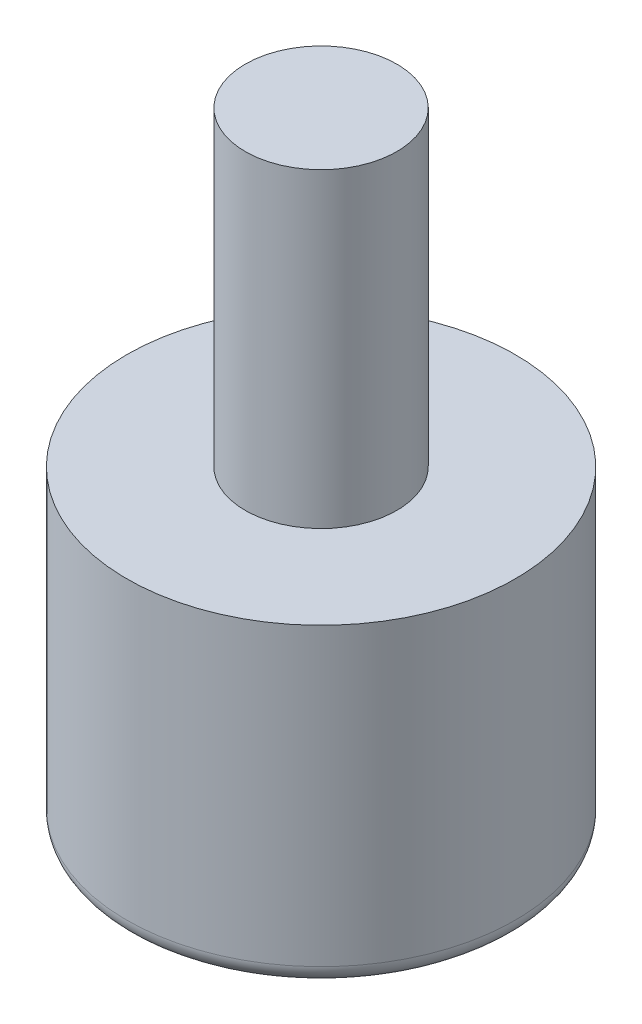
from build123d import *

# Parameters (mm, degrees)
CONG_1_R = 1


with BuildPart() as part:
    # Esquisse1 → Révolution1 (revolve)
    with BuildSketch(Plane.XY, mode=Mode.PRIVATE) as r_volution1_sk:
        with BuildLine():
            Line((10.25, 0), (6, 0))
            ThreePointArc((6, 0), (3.44818793, -2.490919876), (0, -3.4))
            Line((0, -3.4), (0, 0))
            Line((0, 0), (0, 33))
            Line((0, 33), (4, 33))
            Line((4, 33), (4, 16.6))
            Line((4, 16.6), (10.25, 16.6))
            Line((10.25, 16.6), (10.25, 0))
        make_face()
    revolve(r_volution1_sk.sketch.rotate(Axis((0, 33, 0), (0, -1, 0)), 180), axis=Axis((0, 33, 0), (0, -1, 0)))

    # Congé1
    cong_1_edges = [part.edges().sort_by_distance(p)[0] for p in [
        (10.25, 0, 0),
    ]]
    fillet(cong_1_edges, radius=CONG_1_R)


solid = part.part
